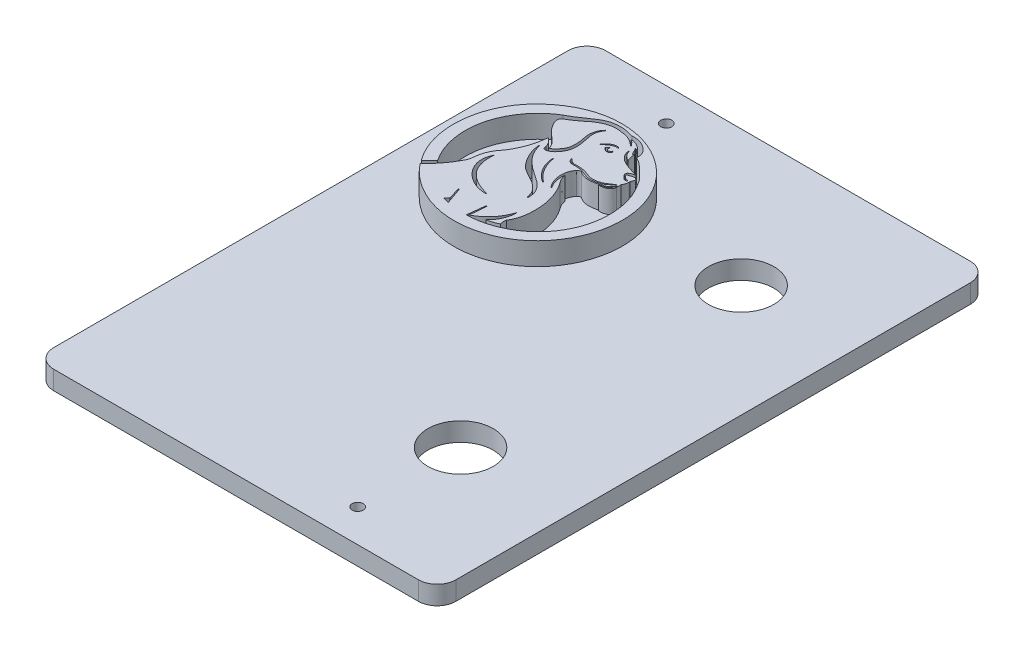
from build123d import *

# Parameters (mm, degrees)
SALIENTE_EXTRUIR1_DEPTH = 2
CORTAR_EXTRUIR1_REACH   = 38.558
CROQUIS2_R              = 0.6
SALIENTE_EXTRUIR2_DEPTH = 2.4
CORTAR_EXTRUIR2_REACH   = 38.582
CROQUIS5_R              = 3.5


with BuildPart() as part:
    # Croquis1 → Saliente-Extruir1 (new body)
    with BuildSketch(Plane(origin=(0, 0, 0), x_dir=(1, 0, 0), z_dir=(0, 1, 0))):
        with BuildLine():
            Line((-19.5, 29.5), (19.5, 29.5))
            ThreePointArc((19.5, 29.5), (20.914213562, 28.914213562), (21.5, 27.5))
            Line((21.5, 27.5), (21.5, -27.5))
            ThreePointArc((21.5, -27.5), (20.914213562, -28.914213562), (19.5, -29.5))
            Line((19.5, -29.5), (-19.5, -29.5))
            ThreePointArc((-19.5, -29.5), (-20.914213562, -28.914213562), (-21.5, -27.5))
            Line((-21.5, -27.5), (-21.5, 27.5))
            ThreePointArc((-21.5, 27.5), (-20.914213562, 28.914213562), (-19.5, 29.5))
        make_face()
    extrude(amount=SALIENTE_EXTRUIR1_DEPTH)

    # Croquis2 → Cortar-Extruir1 (cut, up to next)
    with BuildSketch(Plane(origin=(0, 2, 0), x_dir=(1, 0, 0), z_dir=(0, 1, 0)), mode=Mode.PRIVATE) as cortar_extruir1_sk1:
        with Locations(Location((-9.5, 26, 0), (0, 0, 270))):
            Circle(CROQUIS2_R)
    cortar_extruir1_tool1 = extrude(cortar_extruir1_sk1.sketch, amount=-CORTAR_EXTRUIR1_REACH, mode=Mode.PRIVATE) & part.part
    # Croquis2 → Cortar-Extruir1 (cut, up to next)
    with BuildSketch(Plane(origin=(0, 2, 0), x_dir=(1, 0, 0), z_dir=(0, 1, 0)), mode=Mode.PRIVATE) as cortar_extruir1_sk2:
        with Locations(Location((9.5, -26, 0), (0, 0, 270))):
            Circle(CROQUIS2_R)
    cortar_extruir1_tool2 = extrude(cortar_extruir1_sk2.sketch, amount=-CORTAR_EXTRUIR1_REACH, mode=Mode.PRIVATE) & part.part
    add(cortar_extruir1_tool1.solids().sort_by_distance((-9.5, 2, -26))[0], mode=Mode.SUBTRACT)
    add(cortar_extruir1_tool2.solids().sort_by_distance((9.5, 2, 26))[0], mode=Mode.SUBTRACT)

    # Croquis4 → Saliente-Extruir2 (add)
    with BuildSketch(Plane(origin=(0, 2, 0), x_dir=(1, 0, 0), z_dir=(0, 1, 0))):
        with BuildLine():
            add(Edge.make_bspline(
                [(-16.56319891, 6.737541999), (-14.869837939, 4.566769751), (-10.304452265, 2.334265082), (-4.202747725, 4.350467463), (-1.300899598, 7.907094857), (-0.326737602, 11.406906222), (-0.625257004, 14.662153033), (-2.347616949, 18.358266199), (-6.458184497, 21.316699576), (-11.560130161, 21.332989046), (-14.652337192, 19.630004274), (-18.711499744, 15.779577869), (-19.243465104, 10.424239707), (-16.785022241, 7.093526574)],
                knots=[0, 0, 0, 0, 0.147573539, 0.250522388, 0.323508286, 0.389308099, 0.443162778, 0.498041354, 0.607267521, 0.697259099, 0.760332638, 0.794706299, 1, 1, 1, 1], degree=3))
            Line((-16.785022241, 7.093526574), (-15.911337557, 7.967211258))
            add(Edge.make_bspline(
                [(-15.911337557, 7.967211258), (-17.022025684, 9.586098307), (-17.902411649, 13.992281205), (-15.30352027, 17.726770375), (-13.401761846, 18.857573415)],
                knots=[0, 0, 0, 0, 0.471176739, 1, 1, 1, 1], degree=3))
            add(Edge.make_bspline(
                [(-13.401761846, 18.857573415), (-12.703368152, 19.201545469), (-11.913417712, 19.80244017), (-10.819038106, 20.517482418), (-10.163341629, 20.793219461), (-9.313914241, 20.877487197), (-8.549564549, 20.857144492), (-8.000696973, 20.626210209), (-7.78370772, 20.609601261)],
                knots=[0, 0, 0, 0, 0.37648828, 0.480607193, 0.636085968, 0.714833813, 0.894868691, 1, 1, 1, 1], degree=3))
            add(Edge.make_bspline(
                [(-7.78370772, 20.609601261), (-7.284664306, 20.665485297), (-6.312214298, 20.416259261), (-5.503618318, 19.600056977), (-5.52884977, 19.073803623)],
                knots=[0, 0, 0, 0, 0.492815432, 1, 1, 1, 1], degree=3))
            Line((-5.52884977, 19.073803623), (-5.52884977, 18.835265644))
            add(Edge.make_bspline(
                [(-5.52884977, 18.835265644), (-4.815685758, 18.546407361), (-4.273571291, 17.815403955), (-3.504740246, 17.183452372), (-3.229390123, 16.830048189), (-2.958927777, 16.395461712), (-2.391227572, 15.485551671), (-1.572058068, 13.31298449), (-1.675643138, 9.98830181), (-4.02288354, 5.911906886), (-7.262930962, 4.464996741), (-9.333494899, 4.456641243)],
                knots=[0, 0, 0, 0, 0.110187326, 0.134977538, 0.149214679, 0.177412449, 0.212079474, 0.310622768, 0.523347918, 0.686566431, 1, 1, 1, 1], degree=3))
            Line((-9.333494899, 4.456641243), (-9.123506814, 6.346534009))
            Line((-9.123506814, 6.346534009), (-9.03351192, 6.346534009))
            add(Edge.make_bspline(
                [(-9.03351192, 6.346534009), (-9.040900074, 5.447331862), (-9.206454077, 4.560791068)],
                knots=[0, 0, 0, 1, 1, 1], degree=2))
            add(Edge.make_bspline(
                [(-9.206454077, 4.560791068), (-7.440157644, 5.488858291), (-6.858071054, 7.332698231)],
                knots=[0, 0, 0, 1, 1, 1], degree=2))
            Line((-6.858071054, 7.332698231), (-6.808510276, 7.332698231))
            add(Edge.make_bspline(
                [(-6.808510276, 7.332698231), (-6.869940108, 5.945219113), (-7.835998367, 5.048087035)],
                knots=[0, 0, 0, 1, 1, 1], degree=2))
            add(Edge.make_bspline(
                [(-7.835998367, 5.048087035), (-7.219176796, 5.148913572), (-6.662713393, 5.428147888)],
                knots=[0, 0, 0, 1, 1, 1], degree=2))
            add(Edge.make_bspline(
                [(-6.662713393, 5.428147888), (-6.769161765, 5.776825895), (-6.695874699, 6.128186607)],
                knots=[0, 0, 0, 1, 1, 1], degree=2))
            add(Edge.make_bspline(
                [(-6.695874699, 6.128186607), (-6.27618796, 6.732408918), (-5.832424152, 9.014516483), (-6.41738766, 11.212810243), (-7.310578321, 12.454684184)],
                knots=[0, 0, 0, 0, 0.330119205, 1, 1, 1, 1], degree=3))
            add(Edge.make_bspline(
                [(-7.310578321, 12.454684184), (-7.635355311, 12.877459408), (-7.729623776, 13.406367411)],
                knots=[0, 0, 0, 1, 1, 1], degree=2))
            add(Edge.make_bspline(
                [(-7.729623776, 13.406367411), (-7.848789934, 12.383687949), (-7.310578321, 11.57303635)],
                knots=[0, 0, 0, 1, 1, 1], degree=2))
            add(Edge.make_bspline(
                [(-7.310578321, 11.57303635), (-7.300298725, 11.489635448), (-7.385815377, 11.537561978)],
                knots=[0, 0, 0, 1, 1, 1], degree=2))
            add(Edge.make_bspline(
                [(-7.385815377, 11.537561978), (-8.004297691, 12.343560097), (-8.228799849, 13.6029596), (-7.563105644, 14.437054551)],
                knots=[0, 0, 0, 0, 1, 1, 1, 1], degree=3))
            add(Edge.make_bspline(
                [(-7.563105644, 14.437054551), (-7.312748581, 14.720321571), (-7.083573026, 14.535965523)],
                knots=[0, 0, 0, 1, 1, 1], degree=2))
            add(Edge.make_bspline(
                [(-7.083573026, 14.535965523), (-6.333862192, 14.018668191), (-5.378298761, 14.231328206), (-4.591456168, 14.535965523)],
                knots=[0, 0, 0, 0, 1, 1, 1, 1], degree=3))
            add(Edge.make_bspline(
                [(-4.591456168, 14.535965523), (-4.103336711, 14.745691024), (-3.934094721, 15.226709931)],
                knots=[0, 0, 0, 1, 1, 1], degree=2))
            add(Edge.make_bspline(
                [(-3.934094721, 15.226709931), (-3.886466595, 15.177942482), (-3.898926136, 15.111694737)],
                knots=[0, 0, 0, 1, 1, 1], degree=2))
            add(Edge.make_bspline(
                [(-3.898926136, 15.111694737), (-4.227682065, 14.344581584), (-5.032197375, 14.297891652)],
                knots=[0, 0, 0, 1, 1, 1], degree=2))
            add(Edge.make_bspline(
                [(-5.032197375, 14.297891652), (-4.572400694, 14.213176222), (-3.886928587, 14.470955768), (-3.84175815, 14.995677355)],
                knots=[0, 0, 0, 0, 1, 1, 1, 1], degree=3))
            add(Edge.make_bspline(
                [(-3.84175815, 14.995677355), (-3.830765986, 15.249233016), (-3.846669168, 15.502122034)],
                knots=[0, 0, 0, 1, 1, 1], degree=2))
            add(Edge.make_bspline(
                [(-3.846669168, 15.502122034), (-3.763359289, 15.70495206), (-3.643225562, 15.916665516), (-3.657184991, 16.14546728)],
                knots=[0, 0, 0, 0, 1, 1, 1, 1], degree=3))
            Line((-3.657184991, 16.14546728), (-3.659904001, 16.28122681))
            add(Edge.make_bspline(
                [(-3.659904001, 16.28122681), (-3.639712731, 16.354130672), (-3.418262587, 16.727801846), (-3.726575323, 16.913072682), (-4.012511257, 16.899913856), (-4.243816785, 16.780868484), (-4.458211531, 16.743575479), (-4.469420806, 16.597962134), (-4.420163649, 16.561335408)],
                knots=[0, 0, 0, 0, 0.337179, 0.394734313, 0.627402908, 0.822678513, 0.889477065, 1, 1, 1, 1], degree=3))
            add(Edge.make_bspline(
                [(-4.420163649, 16.561335408), (-4.254442319, 16.302380154), (-3.982637821, 16.28122681)],
                knots=[0, 0, 0, 1, 1, 1], degree=2))
            add(Edge.make_bspline(
                [(-3.982637821, 16.28122681), (-3.835383732, 16.266558115), (-3.881149198, 16.14546728)],
                knots=[0, 0, 0, 1, 1, 1], degree=2))
            add(Edge.make_bspline(
                [(-3.881149198, 16.14546728), (-4.203766308, 16.104085205), (-4.420163649, 16.374596343)],
                knots=[0, 0, 0, 1, 1, 1], degree=2))
            add(Edge.make_bspline(
                [(-4.420163649, 16.374596343), (-4.514221157, 16.454213213), (-4.884728242, 16.944107894), (-4.145885425, 17.165656022), (-3.982637821, 17.158503646)],
                knots=[0, 0, 0, 0, 0.378360646, 1, 1, 1, 1], degree=3))
            add(Edge.make_bspline(
                [(-3.982637821, 17.158503646), (-3.885306833, 17.168070472), (-4.027207613, 17.213536458)],
                knots=[0, 0, 0, 1, 1, 1], degree=2))
            add(Edge.make_bspline(
                [(-4.027207613, 17.213536458), (-4.930746314, 17.484703722), (-6.457312016, 17.79108007), (-6.559304487, 19.03521225)],
                knots=[0, 0, 0, 0, 1, 1, 1, 1], degree=3))
            add(Edge.make_bspline(
                [(-6.559304487, 19.03521225), (-6.565340893, 19.073084391), (-6.528513889, 19.073803623)],
                knots=[0, 0, 0, 1, 1, 1], degree=2))
            add(Edge.make_bspline(
                [(-6.528513889, 19.073803623), (-6.309459926, 18.3722028), (-5.703199303, 18.118769448)],
                knots=[0, 0, 0, 1, 1, 1], degree=2))
            add(Edge.make_bspline(
                [(-5.703199303, 18.118769448), (-5.91818831, 18.551788785), (-5.920495277, 19.03521225)],
                knots=[0, 0, 0, 1, 1, 1], degree=2))
            add(Edge.make_bspline(
                [(-5.920495277, 19.03521225), (-5.941416756, 18.997655754), (-5.971720413, 18.960609399), (-6.054868744, 18.918551851), (-6.088467323, 18.979850789), (-6.095307404, 18.997318798)],
                knots=[0, 0, 0, 0, 0.479863986, 0.649423002, 1, 1, 1, 1], degree=3))
            add(Edge.make_bspline(
                [(-6.095307404, 18.997318798), (-6.244200416, 19.170640714), (-6.258371376, 19.415922057), (-6.424011095, 19.578924224)],
                knots=[0, 0, 0, 0, 1, 1, 1, 1], degree=3))
            add(Edge.make_bspline(
                [(-6.424011095, 19.578924224), (-6.442895175, 19.590810456), (-6.448854361, 19.629554892), (-6.413369307, 19.656013004), (-6.363712937, 19.642202244), (-6.161160454, 19.507616295), (-6.001382479, 19.279649825), (-5.920495277, 19.112889407)],
                knots=[0, 0, 0, 0, 0.081295529, 0.094196736, 0.154111276, 0.241242883, 1, 1, 1, 1], degree=3))
            add(Edge.make_bspline(
                [(-5.920495277, 19.112889407), (-5.906209569, 19.270308044), (-6.009398468, 19.395310871)],
                knots=[0, 0, 0, 1, 1, 1], degree=2))
            add(Edge.make_bspline(
                [(-6.009398468, 19.395310871), (-6.335962842, 19.842904296), (-6.898519361, 20.250617412), (-7.482039745, 20.220118339)],
                knots=[0, 0, 0, 0, 0.992137, 0.992137, 0.992137, 0.992137], degree=3))
            add(Edge.make_bspline(
                [(-7.482039745, 20.220118339), (-7.298259181, 20.199826384), (-6.41800769, 19.152864096), (-7.243906045, 19.870205687)],
                knots=[0.02752662, 0.02752662, 0.02752662, 0.02752662, 1, 1, 1, 1], degree=3))
            add(Edge.make_bspline(
                [(-7.243906045, 19.870205687), (-7.907748152, 20.367417307), (-8.686910911, 20.400422347)],
                knots=[0, 0, 0, 1, 1, 1], degree=2))
            add(Edge.make_bspline(
                [(-8.686910911, 20.400422347), (-9.852463844, 20.69200648), (-10.979658516, 20.085507536), (-11.798173876, 19.326415383)],
                knots=[0, 0, 0, 0, 1, 1, 1, 1], degree=3))
            add(Edge.make_bspline(
                [(-11.798173876, 19.326415383), (-12.114224201, 19.087792421), (-12.529665984, 18.774644524), (-13.038478917, 18.517877964), (-13.250286047, 18.352849039), (-13.305552283, 17.905447447), (-13.011195291, 17.344038294), (-12.511120475, 16.648062078), (-11.68833093, 16.034691286), (-11.163947253, 15.446629749), (-11.07581497, 14.995677355)],
                knots=[0, 0, 0, 0, 0.204538472, 0.261311008, 0.295484115, 0.335428035, 0.477110097, 0.60727909, 0.774102035, 1, 1, 1, 1], degree=3))
            add(Edge.make_bspline(
                [(-11.07581497, 14.995677355), (-10.625989115, 15.303436157), (-10.05469594, 15.924384598), (-10.029184885, 16.914298185), (-10.057851953, 17.502552332), (-10.334735905, 18.48807901), (-10.147260459, 19.298755192), (-9.731811251, 19.719527919)],
                knots=[0, 0, 0, 0, 0.334112163, 0.413274089, 0.565310846, 0.671297566, 1, 1, 1, 1], degree=3))
            add(Edge.make_bspline(
                [(-9.731811251, 19.719527919), (-9.620390895, 19.768471603), (-9.716854879, 19.608481874)],
                knots=[0, 0, 0, 1, 1, 1], degree=2))
            add(Edge.make_bspline(
                [(-9.716854879, 19.608481874), (-10.197751906, 18.965947551), (-9.814032904, 17.787502001), (-9.646672313, 16.265780042), (-10.235791649, 15.164455558), (-10.769388964, 14.614862407), (-11.281660371, 14.694854747)],
                knots=[0, 0, 0, 0, 0.336612698, 0.675631893, 0.736002831, 1, 1, 1, 1], degree=3))
            add(Edge.make_bspline(
                [(-11.281660371, 14.694854747), (-11.398952341, 14.832266484), (-11.394291906, 15.019820047)],
                knots=[0, 0, 0, 1, 1, 1], degree=2))
            add(Edge.make_bspline(
                [(-11.394291906, 15.019820047), (-11.579518269, 15.621682625), (-12.101136355, 15.969209159)],
                knots=[0, 0, 0, 1, 1, 1], degree=2))
            add(Edge.make_bspline(
                [(-12.101136355, 15.969209159), (-12.260523021, 14.089135643), (-13.268954031, 12.540060149)],
                knots=[0, 0, 0, 1, 1, 1], degree=2))
            add(Edge.make_bspline(
                [(-13.268954031, 12.540060149), (-13.683621359, 12.037249499), (-14.325461443, 11.035445685), (-14.276184792, 9.87108376), (-14.493280879, 9.453646922)],
                knots=[0, 0, 0, 0, 0.588640895, 1, 1, 1, 1], degree=3))
            add(Edge.make_bspline(
                [(-14.493280879, 9.453646922), (-15.277010171, 7.906439543), (-16.56319891, 6.737541999)],
                knots=[0, 0, 0, 1, 1, 1], degree=2))
        make_face()
        Polygon((-11.443075702, 4.619350144), (-12.077416611, 4.792936331), (-11.798173876, 5.160939047), (-12.139907639, 6.37951408), (-12.139907639, 6.431589936), (-12.077416611, 6.431589936), align=None, mode=Mode.SUBTRACT)
        with BuildLine():
            add(Edge.make_bspline(
                [(-13.364490999, 11.492750181), (-14.416338746, 9.443759909), (-12.260757352, 7.46952308), (-10.361962054, 7.461034897)],
                knots=[0, 0, 0, 0, 1, 1, 1, 1], degree=3))
            add(Edge.make_bspline(
                [(-10.287319011, 7.525843305), (-13.708540184, 8.44131861), (-13.364490999, 11.492750181)],
                knots=[0, 0, 0, 1, 1, 1], degree=2))
            add(Edge.make_bspline(
                [(-10.361962054, 7.461034897), (-10.352475501, 7.444828391), (-10.183185533, 7.481339376), (-10.287319011, 7.525843305)],
                knots=[0, 0, 0, 0, 1, 1, 1, 1], degree=3))
        make_face(mode=Mode.SUBTRACT)
        with BuildLine():
            add(Edge.make_bspline(
                [(-10.8022826, 12.250253964), (-10.407494722, 11.776272497), (-9.078203701, 11.229167676), (-7.838370706, 10.286852688), (-7.729623776, 9.363283291)],
                knots=[0, 0, 0, 0, 0.409620572, 1, 1, 1, 1], degree=3))
            add(Edge.make_bspline(
                [(-10.8022826, 12.250253964), (-11.764776548, 13.387844851), (-11.895899188, 14.798064926)],
                knots=[0, 0, 0, 1, 1, 1], degree=2))
            add(Edge.make_bspline(
                [(-11.81310047, 14.740158984), (-11.84343857, 14.784962592), (-11.895899188, 14.798064926)],
                knots=[0, 0, 0, 1, 1, 1], degree=2))
            add(Edge.make_bspline(
                [(-7.64869258, 9.34661286), (-7.586546629, 9.979287998), (-8.064224004, 10.953037858), (-10.066645599, 12.213697656), (-11.500728731, 13.310927268), (-11.81310047, 14.740158984)],
                knots=[0, 0, 0, 0, 0.255348433, 0.427022627, 1, 1, 1, 1], degree=3))
            add(Edge.make_bspline(
                [(-7.729623776, 9.363283291), (-7.692681507, 9.338066374), (-7.64869258, 9.34661286)],
                knots=[0, 0, 0, 1, 1, 1], degree=2))
        make_face(mode=Mode.SUBTRACT)
        with BuildLine():
            add(Edge.make_bspline(
                [(-9.935933352, 14.297891652), (-9.905224429, 13.170365394), (-9.229510684, 12.147093482), (-8.292772658, 11.57303635)],
                knots=[0, 0, 0, 0, 1, 1, 1, 1], degree=3))
            Line((-9.935933352, 14.297891652), (-9.872512174, 14.297891652))
            add(Edge.make_bspline(
                [(-8.316018642, 11.674304166), (-8.926154188, 12.118526346), (-9.553170638, 12.999213268), (-9.837180993, 14.005352005), (-9.872512174, 14.297891652)],
                knots=[0, 0, 0, 0, 0.717863198, 1, 1, 1, 1], degree=3))
            add(Edge.make_bspline(
                [(-8.292772658, 11.57303635), (-8.231214463, 11.584986958), (-8.288521074, 11.661598415), (-8.316018642, 11.674304166)],
                knots=[0, 0, 0, 0, 1, 1, 1, 1], degree=3))
        make_face(mode=Mode.SUBTRACT)
        with BuildLine():
            add(Edge.make_bspline(
                [(-8.922904538, 15.32680976), (-8.839745288, 14.864698272), (-8.412202596, 14.798064926)],
                knots=[0, 0, 0, 1, 1, 1], degree=2))
            add(Edge.make_bspline(
                [(-7.385815377, 14.755235535), (-7.130364563, 14.682670309), (-6.807403969, 14.526446556), (-6.375965117, 14.385377009), (-6.112816431, 14.353101161), (-5.835322286, 14.344503275), (-5.530355183, 14.397279317), (-5.086186228, 14.479966206), (-4.617357896, 14.722898324), (-3.57370104, 15.659781237), (-4.604624016, 14.900805458), (-5.076185815, 14.659268184), (-5.606760631, 14.489297983), (-6.232113695, 14.51555787), (-6.810530208, 14.771389481), (-7.337923768, 14.916414767), (-7.889079322, 14.949106827), (-8.472820025, 14.870814121), (-8.796789361, 15.191169525), (-8.922904538, 15.32680976)],
                knots=[0, 0, 0, 0, 0.087377277, 0.11828631, 0.149286178, 0.174626519, 0.209512431, 0.251954985, 0.318710096, 0.414242945, 0.511634606, 0.549469259, 0.609050351, 0.687936415, 0.751069772, 0.816729927, 0.866879434, 0.934435981, 1, 1, 1, 1], degree=3))
            add(Edge.make_bspline(
                [(-8.412202596, 14.798064926), (-7.896011364, 14.832360541), (-7.385815377, 14.755235535)],
                knots=[0, 0, 0, 1, 1, 1], degree=2))
        make_face(mode=Mode.SUBTRACT)
        with BuildLine():
            add(Edge.make_bspline(
                [(-7.310578321, 18.025537555), (-7.464869812, 17.661902118), (-8.027738081, 17.796245649), (-8.135896475, 18.118769448)],
                knots=[0, 0, 0, 0, 1, 1, 1, 1], degree=3))
            Line((-8.135896475, 18.118769448), (-7.872668211, 18.381997712))
            Line((-7.872668211, 18.381997712), (-7.872668211, 18.118769448))
            add(Edge.make_bspline(
                [(-7.872668211, 18.118769448), (-7.674623341, 17.781956656), (-7.385815377, 18.181935109)],
                knots=[0, 0, 0, 1, 1, 1], degree=2))
            Line((-7.385815377, 18.181935109), (-7.310578321, 18.025537555))
        make_face(mode=Mode.SUBTRACT)
        with BuildLine():
            add(Edge.make_bspline(
                [(-8.737879513, 18.118769448), (-8.341711084, 18.348607189), (-7.875931121, 18.93147851), (-7.310578321, 18.689489435)],
                knots=[0, 0, 0, 0, 1, 1, 1, 1], degree=3))
            add(Edge.make_bspline(
                [(-8.737879513, 18.118769448), (-8.499572472, 18.404283702), (-8.087129642, 18.955475581), (-7.410192168, 18.863737849), (-7.310578321, 18.689489435)],
                knots=[0, 0, 0, 0, 0.684259101, 1, 1, 1, 1], degree=3))
        make_face(mode=Mode.SUBTRACT)
    extrude(amount=SALIENTE_EXTRUIR2_DEPTH)

    # Croquis5 → Cortar-Extruir2 (cut, up to next)
    with BuildSketch(Plane(origin=(0, 2, 0), x_dir=(1, 0, 0), z_dir=(0, 1, 0)), mode=Mode.PRIVATE) as cortar_extruir2_sk1:
        with Locations(Location((9.5, -15, 0), (0, 0, 270))):
            Circle(CROQUIS5_R)
    cortar_extruir2_tool1 = extrude(cortar_extruir2_sk1.sketch, amount=-CORTAR_EXTRUIR2_REACH, mode=Mode.PRIVATE) & part.part
    # Croquis5 → Cortar-Extruir2 (cut, up to next)
    with BuildSketch(Plane(origin=(0, 2, 0), x_dir=(1, 0, 0), z_dir=(0, 1, 0)), mode=Mode.PRIVATE) as cortar_extruir2_sk2:
        with Locations(Location((9.5, 15, 0), (0, 0, 270))):
            Circle(CROQUIS5_R)
    cortar_extruir2_tool2 = extrude(cortar_extruir2_sk2.sketch, amount=-CORTAR_EXTRUIR2_REACH, mode=Mode.PRIVATE) & part.part
    add(cortar_extruir2_tool1.solids().sort_by_distance((9.5, 2, 15))[0], mode=Mode.SUBTRACT)
    add(cortar_extruir2_tool2.solids().sort_by_distance((9.5, 2, -15))[0], mode=Mode.SUBTRACT)


solid = part.part
